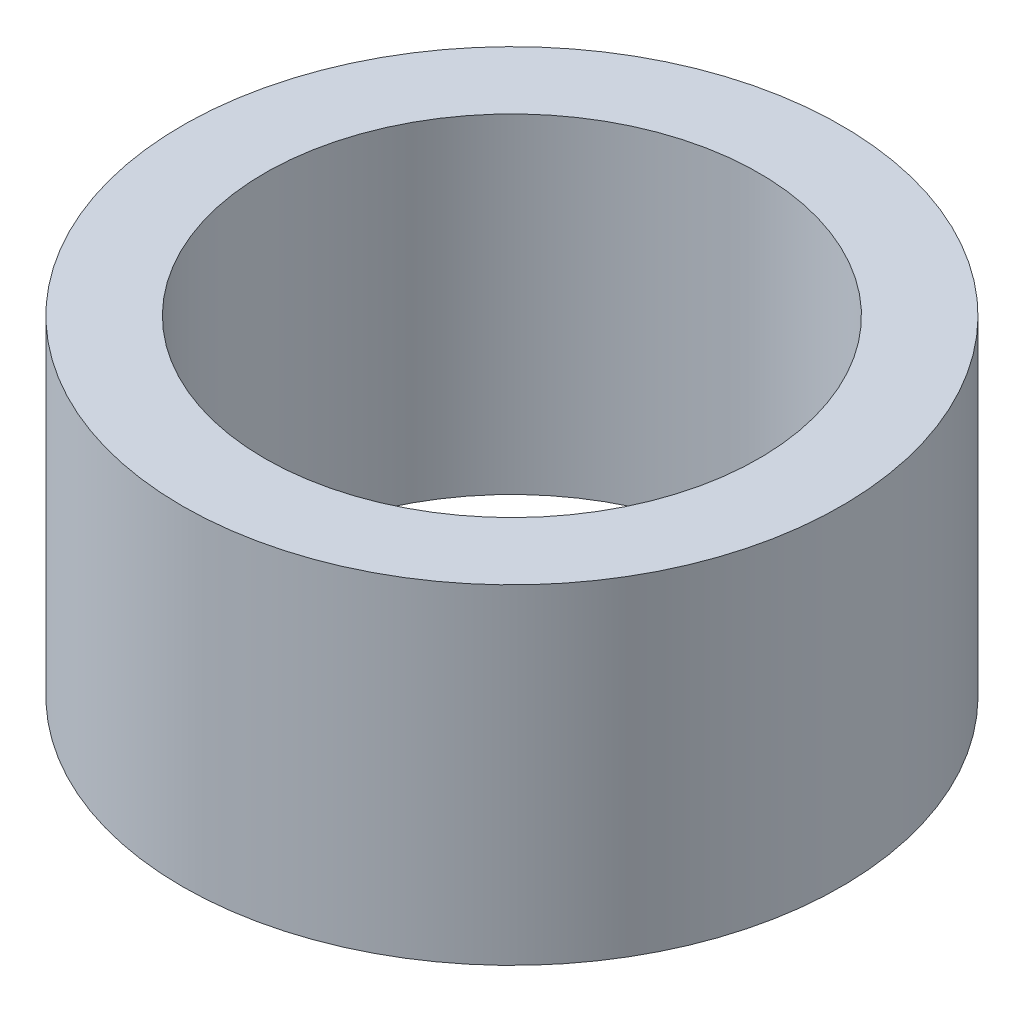
from build123d import *

# Parameters (mm, degrees)
SKETCH1_R           = 20
SKETCH1_R_2         = 15
BOSS_EXTRUDE1_DEPTH = 20


with BuildPart() as part:
    # Sketch1 → Boss-Extrude1 (new body)
    with BuildSketch(Plane(origin=(0, 0, 0), x_dir=(1, 0, 0), z_dir=(0, 1, 0))):
        with Locations(Location((0, 0, 0), (0, 0, 270))):
            Circle(SKETCH1_R)
        with Locations(Location((0, 0, 0), (0, 0, 270))):
            Circle(SKETCH1_R_2, mode=Mode.SUBTRACT)
    extrude(amount=BOSS_EXTRUDE1_DEPTH)


solid = part.part
